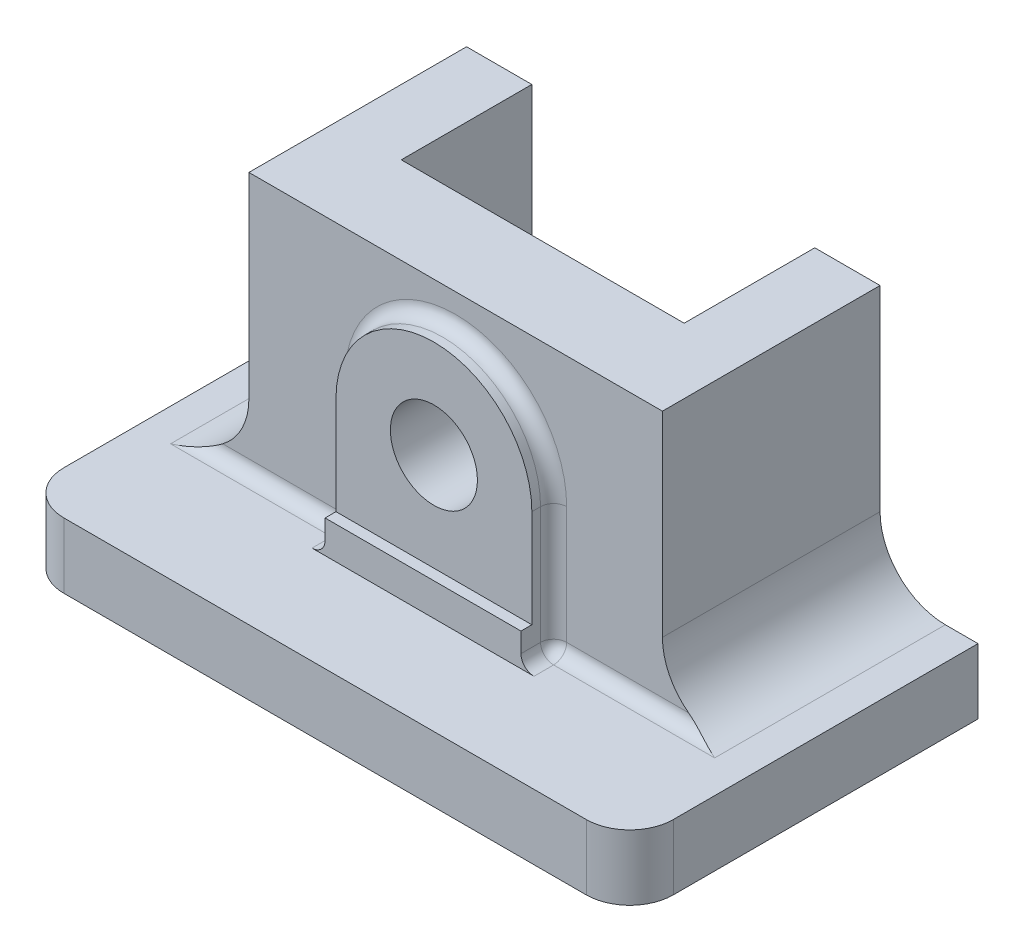
from build123d import *

# Parameters (mm, degrees)
BOSS_EXTRUDE2_DEPTH  = 9.525
BOSS_EXTRUDE4_DEPTH  = 38.1
SKETCH5_R            = 6.35
BOSS_EXTRUDE6_DEPTH  = 3.175
SKETCH5_6_W          = 28.575
SKETCH5_6_H          = 4.7625
BOSS_EXTRUDE10_DEPTH = 4.7625
SKETCH5_7_R          = 6.35
CUT_EXTRUDE1_DEPTH   = 73.470722537
FILLET1_R            = 9.525
FILLET4_R            = 1.905
FILLET5_R            = 1.905


with BuildPart() as part:
    # Sketch1 → Boss-Extrude2 (new body)
    with BuildSketch(Plane(origin=(0, 0, 0), x_dir=(1, 0, 0), z_dir=(0, 1, 0))):
        with BuildLine():
            Line((-38.1, -25.4), (38.1, -25.4))
            ThreePointArc((38.1, -25.4), (42.590128061, -23.540128061), (44.45, -19.05))
            Line((44.45, -19.05), (44.45, 25.4))
            Line((44.45, 25.4), (-44.45, 25.4))
            Line((-44.45, 25.4), (-44.45, -19.05))
            ThreePointArc((-44.45, -19.05), (-42.590128061, -23.540128061), (-38.1, -25.4))
        make_face()
    extrude(amount=BOSS_EXTRUDE2_DEPTH)

    # Sketch4 → Boss-Extrude4 (add)
    with BuildSketch(Plane(origin=(0, 9.525, 0), x_dir=(1, 0, 0), z_dir=(0, 1, 0))):
        Polygon((30.1625, 25.4), (30.1625, -6.35), (-30.1625, -6.35), (-30.1625, 25.4), (-20.6375, 25.4), (-20.6375, 6.35), (20.6375, 6.35), (20.6375, 25.4), align=None)
    extrude(amount=BOSS_EXTRUDE4_DEPTH)

    # Sketch5 → Boss-Extrude6 (add)
    with BuildSketch(Plane.XY.offset(6.35)):
        with BuildLine():
            Line((-14.2875, 28.575), (-14.2875, 14.2875))
            Line((-14.2875, 14.2875), (14.2875, 14.2875))
            Line((14.2875, 14.2875), (14.2875, 28.575))
            ThreePointArc((14.2875, 28.575), (0, 42.8625), (-14.2875, 28.575))
        make_face()
        with Locations((0, 28.575)):
            Circle(SKETCH5_R, mode=Mode.SUBTRACT)
    extrude(amount=BOSS_EXTRUDE6_DEPTH)

    # Sketch5<6> → Boss-Extrude10 (add)
    with BuildSketch(Plane.XY.offset(6.35)):
        with Locations((0, 11.90625)):
            Rectangle(SKETCH5_6_W, SKETCH5_6_H)
    extrude(amount=BOSS_EXTRUDE10_DEPTH)

    # Sketch5<7> → Cut-Extrude1 (cut, through all)
    with BuildSketch(Plane.XY.offset(6.35)):
        with Locations((0, 28.575)):
            Circle(SKETCH5_7_R)
    extrude(amount=-CUT_EXTRUDE1_DEPTH, mode=Mode.SUBTRACT)

    # Fillet1
    fillet1_edges = [part.edges().sort_by_distance(p)[0] for p in [
        (-30.1625, 9.525, -9.525),
        (30.1625, 9.525, -9.525),
    ]]
    fillet(fillet1_edges, radius=FILLET1_R)

    # Fillet4
    fillet4_edges = [part.edges().sort_by_distance(p)[0] for p in [
        (14.2875, 19.05, 6.35),
        (-14.2875, 19.05, 6.35),
        (0, 42.8625, 6.35),
    ]]
    fillet(fillet4_edges, radius=FILLET4_R)

    # Fillet5
    fillet5_edges = [part.edges().sort_by_distance(p)[0] for p in [
        (-14.2875, 9.525, 9.68375),
        (-14.845461582, 9.525, 6.907961582),
        (14.2875, 9.525, 9.68375),
        (14.845461582, 9.525, 6.907961582),
        (-27.94, 9.525, 6.35),
        (27.94, 9.525, 6.35),
    ]]
    fillet(fillet5_edges, radius=FILLET5_R)


solid = part.part
